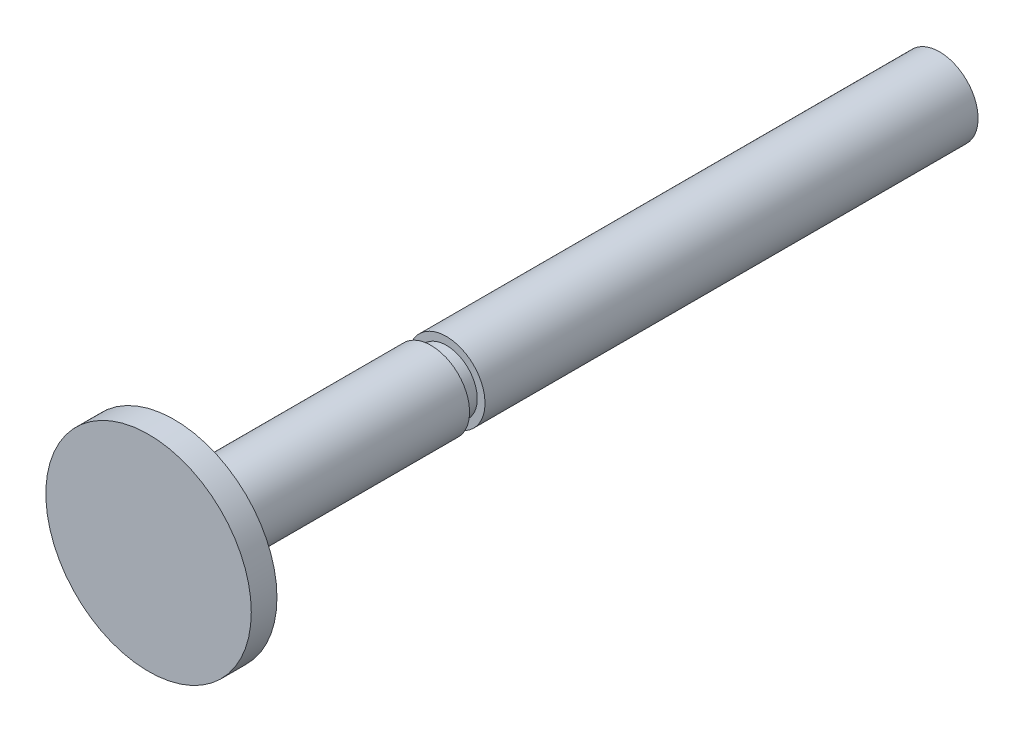
from build123d import *

# Parameters (mm, degrees)
SKETCH1_R           = 2
BOSS_EXTRUDE1_DEPTH = 0.5
SKETCH2_R           = 0.75
BOSS_EXTRUDE2_DEPTH = 5
SKETCH3_R           = 0.6
BOSS_EXTRUDE3_DEPTH = 0.3
SKETCH4_R           = 0.75
BOSS_EXTRUDE4_DEPTH = 9.6


with BuildPart() as part:
    # Sketch1 → Boss-Extrude1 (new body)
    with BuildSketch(Plane.XY):
        Circle(SKETCH1_R)
    extrude(amount=BOSS_EXTRUDE1_DEPTH)

    # Sketch2 → Boss-Extrude2 (add)
    with BuildSketch(Plane(origin=(0, 0, 0), x_dir=(-1, 0, 0), z_dir=(0, 0, -1))):
        Circle(SKETCH2_R)
    extrude(amount=BOSS_EXTRUDE2_DEPTH)

    # Sketch3 → Boss-Extrude3 (add)
    with BuildSketch(Plane(origin=(0, 0, -5), x_dir=(-1, 0, 0), z_dir=(0, 0, -1))):
        Circle(SKETCH3_R)
    extrude(amount=BOSS_EXTRUDE3_DEPTH)

    # Sketch4 → Boss-Extrude4 (add)
    with BuildSketch(Plane(origin=(0, 0, -5.3), x_dir=(-1, 0, 0), z_dir=(0, 0, -1))):
        Circle(SKETCH4_R)
    extrude(amount=BOSS_EXTRUDE4_DEPTH)


solid = part.part
